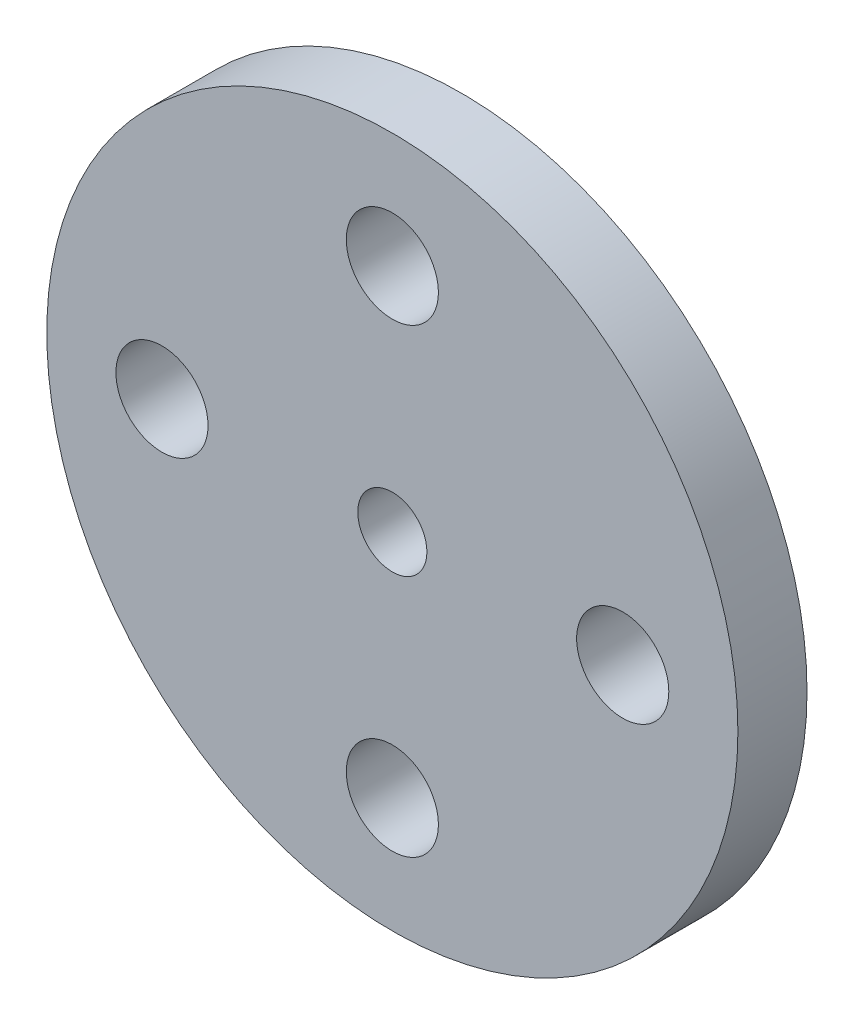
from build123d import *

# Parameters (mm, degrees)
SKETCH_1_R          = 4.5
SKETCH_1_R_2        = 3.5
EXTRUDE_1_DEPTH     = 5
SKETCH_2_R          = 15
EXTRUDE_2_DEPTH     = 3
SKETCH_3_R          = 2
CUT_EXTRUDE_1_DEPTH = 3
SKETCH_4_R          = 1.5
CUT_EXTRUDE_2_DEPTH = 3


with BuildPart() as part:
    # 草图1 → 凸台-拉伸1 (new body)
    with BuildSketch(Plane.XY):
        Circle(SKETCH_1_R)
        Circle(SKETCH_1_R_2, mode=Mode.SUBTRACT)
    extrude(amount=EXTRUDE_1_DEPTH)

    # 草图2 → 凸台-拉伸2 (add)
    with BuildSketch(Plane.XY.offset(5)):
        Circle(SKETCH_2_R)
    extrude(amount=EXTRUDE_2_DEPTH)

    # 草图3 → 切除-拉伸1 (cut)
    with BuildSketch(Plane.XY.offset(8)):
        with Locations((-10, 0)):
            Circle(SKETCH_3_R)
        with Locations((10, 0)):
            Circle(SKETCH_3_R)
        with Locations((0, 10)):
            Circle(SKETCH_3_R)
        with Locations((0, -10)):
            Circle(SKETCH_3_R)
    extrude(amount=-CUT_EXTRUDE_1_DEPTH, mode=Mode.SUBTRACT)

    # 草图4 → 切除-拉伸2 (cut)
    with BuildSketch(Plane.XY.offset(8)):
        Circle(SKETCH_4_R)
    extrude(amount=-CUT_EXTRUDE_2_DEPTH, mode=Mode.SUBTRACT)


solid = part.part
